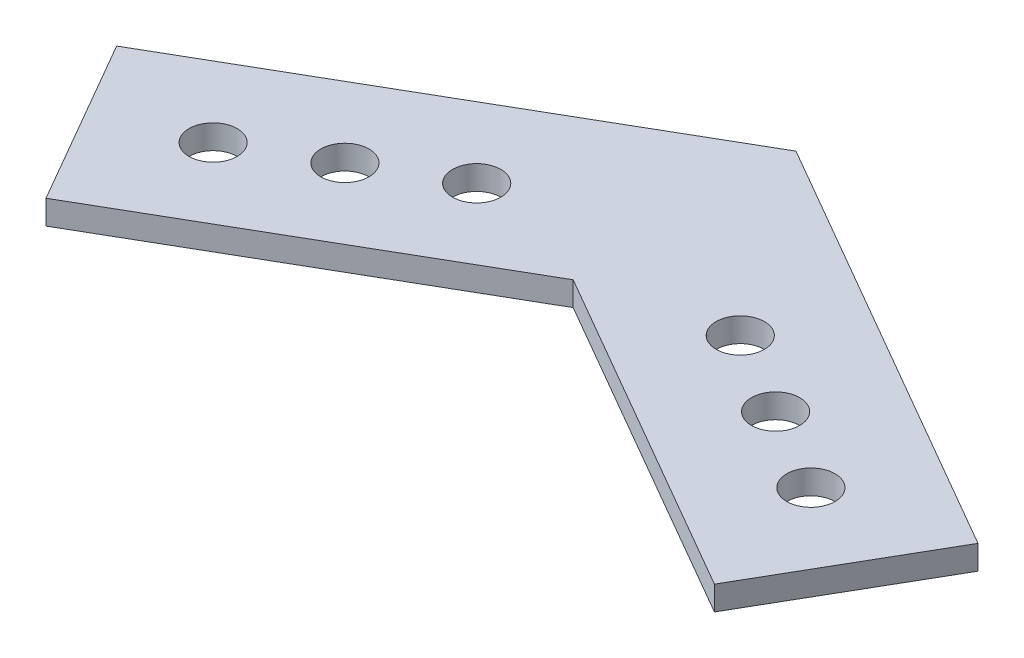
from build123d import *

# Parameters (mm, degrees)
BOSS_EXTRUDE1_DEPTH = 3.175
SKETCH2_R           = 3.175
CUT_EXTRUDE2_DEPTH  = 3.175
LPATTERN5_COUNT     = 3
LPATTERN5_PITCH     = 12.7
SKETCH7_R           = 3.175
CUT_EXTRUDE3_DEPTH  = 3.175
LPATTERN6_COUNT     = 3
LPATTERN6_PITCH     = 12.7


with BuildPart() as part:
    # Sketch1 → Boss-Extrude1 (new body)
    with BuildSketch(Plane(origin=(0, 0, 0), x_dir=(1, 0, 0), z_dir=(0, 1, 0))):
        Polygon((-25.4, 14.664696837), (0, 29.329393675), (25.4, 14.664696837), (56.694090512, -3.402954744), (43.994090512, -25.4), (0, 0), (-43.994090512, -25.4), (-56.694090512, -3.402954744), align=None)
    extrude(amount=BOSS_EXTRUDE1_DEPTH)

    # Sketch2 → Cut-Extrude2 (cut)
    with BuildSketch(Plane(origin=(0, 3.175, 0), x_dir=(1, 0, 0), z_dir=(0, 1, 0))):
        with Locations(Location((-39.345567884, -8.051477372, 0), (0, 0, 270))):
            Circle(SKETCH2_R)
    cut_extrude2 = extrude(amount=-CUT_EXTRUDE2_DEPTH, mode=Mode.SUBTRACT)

    # LPattern5: Cut-Extrude2 ×3
    with Locations(*[Vector(0.866025403784438, 0, -0.5000000000000012) * (i * LPATTERN5_PITCH) for i in range(1, LPATTERN5_COUNT)]):
        add(cut_extrude2, mode=Mode.SUBTRACT)

    # Sketch7 → Cut-Extrude3 (cut)
    with BuildSketch(Plane(origin=(0, 3.175, 0), x_dir=(1, 0, 0), z_dir=(0, 1, 0))):
        with Locations(Location((39.345567884, -8.051477372, 0), (0, 0, 270))):
            Circle(SKETCH7_R)
    cut_extrude3 = extrude(amount=-CUT_EXTRUDE3_DEPTH, mode=Mode.SUBTRACT)

    # LPattern6: Cut-Extrude3 ×3
    with Locations(*[Vector(-0.8660254037844382, 0, -0.500000000000001) * (i * LPATTERN6_PITCH) for i in range(1, LPATTERN6_COUNT)]):
        add(cut_extrude3, mode=Mode.SUBTRACT)


solid = part.part
